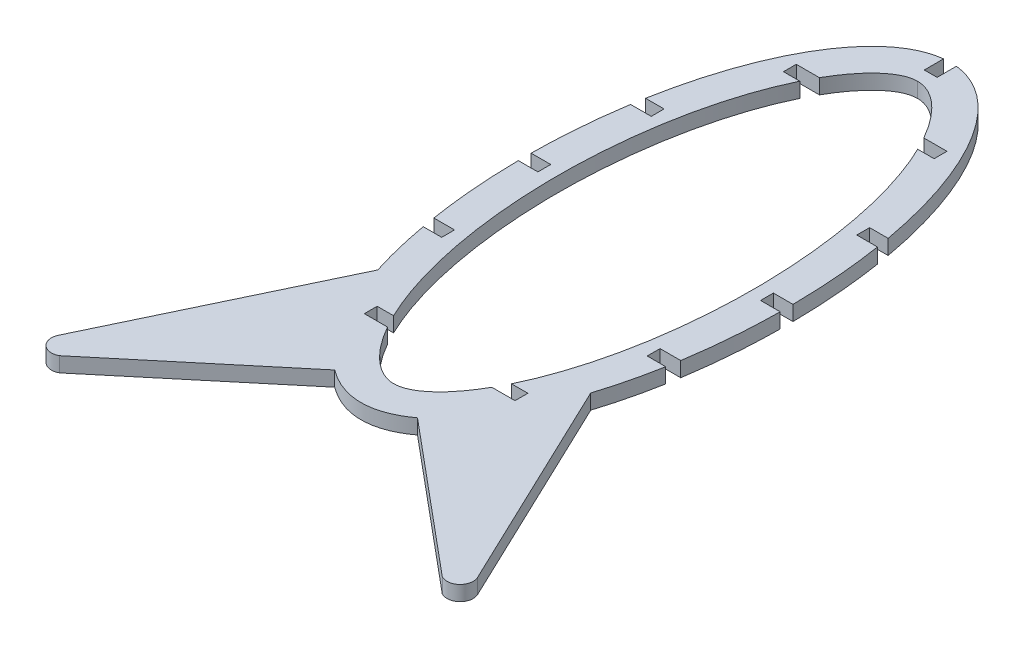
from build123d import *

# Parameters (mm, degrees)
BOSS_EXTRUDE2_DEPTH = 2.8956


with BuildPart() as part:
    # Sketch1 → Boss-Extrude2 (new body)
    with BuildSketch(Plane(origin=(0, 0, 0), x_dir=(1, 0, 0), z_dir=(0, 1, 0))):
        with BuildLine():
            Line((21.59, 1.2446), (25.393976036, 1.2446))
            add(Edge.make_bspline(
                [(25.393976036, 1.2446), (25.305125525, 10.422131382), (23.943355437, 19.0754)],
                knots=[4.73416848, 4.73416848, 4.73416848, 5.052697334, 5.052697334, 5.052697334], degree=2, weights=[1, 0.987344206, 1]))
            Line((23.943355437, 19.0754), (19.930240776, 19.0754))
            Line((19.930240776, 19.0754), (19.930240776, 21.5646))
            Line((19.930240776, 21.5646), (23.522368768, 21.5646))
            add(Edge.make_bspline(
                [(23.522368768, 21.5646), (17.413838434, 55.296547713), (1.2446, 57.081350193)],
                knots=[5.099304053, 5.099304053, 5.099304053, 6.234165678, 6.234165678, 6.234165678], degree=2, weights=[1, 0.843284611, 1]))
            Line((1.2446, 57.081350193), (1.2446, 53.34))
            Line((1.2446, 53.34), (-1.2446, 53.34))
            Line((-1.2446, 53.34), (-1.2446, 57.081350193))
            add(Edge.make_bspline(
                [(-1.2446, 57.081350193), (-17.413838434, 55.296547713), (-23.522368768, 21.5646)],
                knots=[0.049019629, 0.049019629, 0.049019629, 1.183881254, 1.183881254, 1.183881254], degree=2, weights=[1, 0.843284611, 1]))
            Line((-23.522368768, 21.5646), (-19.930240776, 21.5646))
            Line((-19.930240776, 21.5646), (-19.930240776, 19.0754))
            Line((-19.930240776, 19.0754), (-23.943355437, 19.0754))
            add(Edge.make_bspline(
                [(-23.943355437, 19.0754), (-25.305125525, 10.422131382), (-25.393976036, 1.2446)],
                knots=[1.230487974, 1.230487974, 1.230487974, 1.549016827, 1.549016827, 1.549016827], degree=2, weights=[1, 0.987344206, 1]))
            Line((-25.393976036, 1.2446), (-21.59, 1.2446))
            Line((-21.59, 1.2446), (-21.59, -1.2446))
            Line((-21.59, -1.2446), (-25.393976036, -1.2446))
            add(Edge.make_bspline(
                [(-25.393976036, -1.2446), (-25.305125525, -10.422131382), (-23.943355437, -19.0754)],
                knots=[1.592575826, 1.592575826, 1.592575826, 1.91110468, 1.91110468, 1.91110468], degree=2, weights=[1, 0.987344206, 1]))
            Line((-23.943355437, -19.0754), (-19.930240776, -19.0754))
            Line((-19.930240776, -19.0754), (-19.930240776, -21.5646))
            Line((-19.930240776, -21.5646), (-23.522368768, -21.5646))
            add(Edge.make_bspline(
                [(-23.522368768, -21.5646), (-22.395811131, -27.785569894), (-20.658836503, -33.249220312)],
                knots=[1.957711399, 1.957711399, 1.957711399, 2.191722412, 2.191722412, 2.191722412], degree=2, weights=[1, 0.993162662, 1]))
            Line((-20.658836503, -33.249220312), (-40.656934115, -75.189915873))
            ThreePointArc((-40.656934115, -75.189915873), (-40.089838211, -78.146952179), (-37.097948163, -78.484969079))
            Line((-37.097948163, -78.484969079), (-8.029094451, -54.219568092))
            add(Edge.make_bspline(
                [(-8.029094451, -54.219568092), (0, -60.238814416), (8.029094451, -54.219568092)],
                knots=[2.819970364, 2.819970364, 2.819970364, 3.463214943, 3.463214943, 3.463214943], degree=2, weights=[1, 0.948723851, 1]))
            Line((8.029094451, -54.219568092), (37.097948163, -78.484969079))
            ThreePointArc((37.097948163, -78.484969079), (40.089838211, -78.146952179), (40.656934115, -75.189915873))
            Line((40.656934115, -75.189915873), (20.658836503, -33.249220312))
            add(Edge.make_bspline(
                [(20.658836503, -33.249220312), (22.395811131, -27.785569894), (23.522368768, -21.5646)],
                knots=[4.091462895, 4.091462895, 4.091462895, 4.325473908, 4.325473908, 4.325473908], degree=2, weights=[1, 0.993162662, 1]))
            Line((23.522368768, -21.5646), (19.930240776, -21.5646))
            Line((19.930240776, -21.5646), (19.930240776, -19.0754))
            Line((19.930240776, -19.0754), (23.943355437, -19.0754))
            add(Edge.make_bspline(
                [(23.943355437, -19.0754), (25.305125525, -10.422131382), (25.393976036, -1.2446)],
                knots=[4.372080627, 4.372080627, 4.372080627, 4.690609481, 4.690609481, 4.690609481], degree=2, weights=[1, 0.987344206, 1]))
            Line((25.393976036, -1.2446), (21.59, -1.2446))
            Line((21.59, -1.2446), (21.59, 1.2446))
        make_face()
        with BuildLine():
            Line((-14.613224312, -41.884600001), (-10.124198394, -41.884600001))
            add(Edge.make_bspline(
                [(0, -50.8), (-0.374242122, -50.8), (-1.087449753, -50.722280744), (-2.740425126, -50.190283538), (-5.318112389, -48.514264833), (-8.117471478, -45.20633596), (-9.696301311, -42.637606864), (-10.124198394, -41.884600001)],
                knots=[-3.141592654, -3.141592654, -3.141592654, -3.141592654, -3.043417883, -2.945243113, -2.748893572, -2.552544031, -2.478028469, -2.478028469, -2.478028469, -2.478028469], degree=3))
            add(Edge.make_bspline(
                [(0, -50.8), (0.374242122, -50.8), (1.087449753, -50.722280744), (2.740425126, -50.190283538), (5.318112389, -48.514264833), (8.117471478, -45.20633596), (9.696301311, -42.637606864), (10.124198394, -41.884600001)],
                knots=[-3.141592654, -3.141592654, -3.141592654, -3.141592654, -3.043417883, -2.945243113, -2.748893572, -2.552544031, -2.478028469, -2.478028469, -2.478028469, -2.478028469], degree=3))
            Line((10.124198394, -41.884600001), (14.613224312, -41.884600001))
            Line((14.613224312, -41.884600001), (14.613224312, -39.395400001))
            Line((14.613224312, -39.395400001), (11.431305901, -39.395400001))
            add(Edge.make_bspline(
                [(11.431305901, -39.395400001), (11.677149239, -38.889598832), (12.987812642, -36.070874709), (15.148196965, -30.166196648), (18.099752632, -17.775460251), (19.683498245, 0), (18.099752632, 17.775460251), (15.148196965, 30.166196648), (12.987812642, 36.070874709), (11.677149239, 38.889598832), (11.431305901, 39.395400001)],
                knots=[-2.400745736, -2.400745736, -2.400745736, -2.400745736, -2.35619449, -2.159844949, -1.963495408, -1.570796327, -1.178097245, -0.981747704, -0.785398163, -0.740846918, -0.740846918, -0.740846918, -0.740846918], degree=3))
            Line((11.431305901, 39.395400001), (14.613224312, 39.395400001))
            Line((14.613224312, 39.395400001), (14.613224312, 41.884600001))
            Line((14.613224312, 41.884600001), (10.124198394, 41.884600001))
            add(Edge.make_bspline(
                [(10.124198394, 41.884600001), (9.696301311, 42.637606864), (8.117471478, 45.20633596), (5.318112389, 48.514264833), (2.740425126, 50.190283538), (1.087449753, 50.722280744), (0.374242122, 50.8), (0, 50.8)],
                knots=[-0.663564185, -0.663564185, -0.663564185, -0.663564185, -0.589048623, -0.392699082, -0.196349541, -0.09817477, 0, 0, 0, 0], degree=3))
            add(Edge.make_bspline(
                [(-10.124198394, 41.884600001), (-9.696301311, 42.637606864), (-8.117471478, 45.20633596), (-5.318112389, 48.514264833), (-2.740425126, 50.190283538), (-1.087449753, 50.722280744), (-0.374242122, 50.8), (0, 50.8)],
                knots=[-0.663564185, -0.663564185, -0.663564185, -0.663564185, -0.589048623, -0.392699082, -0.196349541, -0.09817477, 0, 0, 0, 0], degree=3))
            Line((-10.124198394, 41.884600001), (-14.613224312, 41.884600001))
            Line((-14.613224312, 41.884600001), (-14.613224312, 39.395400001))
            Line((-14.613224312, 39.395400001), (-11.431305901, 39.395400001))
            add(Edge.make_bspline(
                [(-11.431305901, -39.395400001), (-11.677149239, -38.889598832), (-12.987812642, -36.070874709), (-15.148196965, -30.166196648), (-18.099752632, -17.775460251), (-19.683498245, 0), (-18.099752632, 17.775460251), (-15.148196965, 30.166196648), (-12.987812642, 36.070874709), (-11.677149239, 38.889598832), (-11.431305901, 39.395400001)],
                knots=[-2.400745736, -2.400745736, -2.400745736, -2.400745736, -2.35619449, -2.159844949, -1.963495408, -1.570796327, -1.178097245, -0.981747704, -0.785398163, -0.740846918, -0.740846918, -0.740846918, -0.740846918], degree=3))
            Line((-11.431305901, -39.395400001), (-14.613224312, -39.395400001))
            Line((-14.613224312, -39.395400001), (-14.613224312, -41.884600001))
        make_face(mode=Mode.SUBTRACT)
    extrude(amount=BOSS_EXTRUDE2_DEPTH)


solid = part.part
